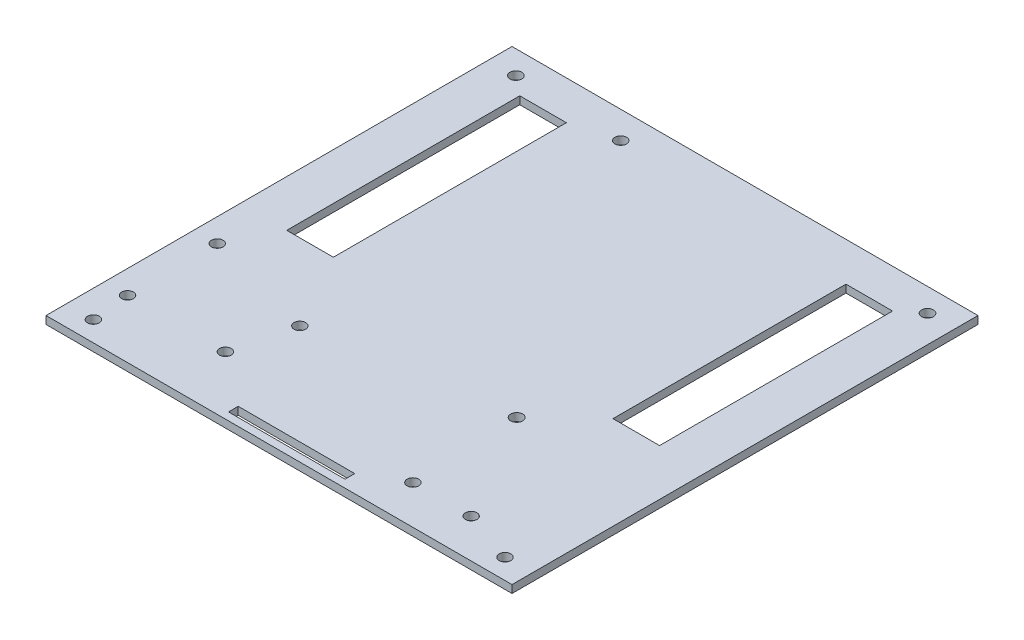
from build123d import *

# Parameters (mm, degrees)
SKETCH1_W           = 120
SKETCH1_H           = 120
BOSS_EXTRUDE1_DEPTH = 2
SKETCH2_R           = 1.525
SKETCH2_R_2         = 1.5
CUT_EXTRUDE1_DEPTH  = 2
SKETCH4_R           = 1.5
SKETCH4_R_2         = 1.55
SKETCH4_W           = 12
SKETCH4_H           = 60
CUT_EXTRUDE2_DEPTH  = 85.876380696
SKETCH5_R           = 1.5
SKETCH5_W           = 30
SKETCH5_H           = 2.5
CUT_EXTRUDE3_DEPTH  = 85.876380696


with BuildPart() as part:
    # Sketch1 → Boss-Extrude1 (new body)
    with BuildSketch(Plane(origin=(0, 0, 0), x_dir=(1, 0, 0), z_dir=(0, 1, 0))):
        Rectangle(SKETCH1_W, SKETCH1_H)
    extrude(amount=BOSS_EXTRUDE1_DEPTH)

    # Sketch2 → Cut-Extrude1 (cut)
    with BuildSketch(Plane(origin=(0, 2, 0), x_dir=(1, 0, 0), z_dir=(0, 1, 0))):
        with Locations(Location((-53, 54, 0), (0, 0, 270))):
            Circle(SKETCH2_R)
        with Locations(Location((-53, -54.8, 0), (0, 0, 270))):
            Circle(SKETCH2_R_2)
        with Locations(Location((53, 54, 0), (0, 0, 90))):
            Circle(SKETCH2_R)
        with Locations(Location((53, -54.8, 0), (0, 0, 90))):
            Circle(SKETCH2_R_2)
    extrude(amount=-CUT_EXTRUDE1_DEPTH, mode=Mode.SUBTRACT)

    # Sketch4 → Cut-Extrude2 (cut, through all)
    with BuildSketch(Plane(origin=(0, 2, 0), x_dir=(1, 0, 0), z_dir=(0, 1, 0))):
        with Locations(Location((-25, 53, 0), (0, 0, 270))):
            Circle(SKETCH4_R)
        with Locations(Location((-25, -29.63, 0), (0, 0, 270))):
            Circle(SKETCH4_R)
        with Locations(Location((23.34, -22.13, 0), (0, 0, 270))):
            Circle(SKETCH4_R_2)
        with Locations((-42, 20)):
            Rectangle(SKETCH4_W, SKETCH4_H)
        with Locations((42, 20)):
            Rectangle(SKETCH4_W, SKETCH4_H)
    extrude(amount=-CUT_EXTRUDE2_DEPTH, mode=Mode.SUBTRACT)

    # Sketch5 → Cut-Extrude3 (cut, through all)
    with BuildSketch(Plane(origin=(0, 2, 0), x_dir=(1, 0, 0), z_dir=(0, 1, 0))):
        with Locations(Location((-54, -45, 0), (0, 0, 270))):
            Circle(SKETCH5_R)
        with Locations(Location((-28.82, -45, 0), (0, 0, 270))):
            Circle(SKETCH5_R)
        with Locations(Location((-54, -21.9, 0), (0, 0, 270))):
            Circle(SKETCH5_R)
        with Locations(Location((24.479587092, -50, 0), (0, 0, 270))):
            Circle(SKETCH5_R)
        with Locations(Location((39.479587092, -50, 0), (0, 0, 270))):
            Circle(SKETCH5_R)
        with Locations((0, -56.75)):
            Rectangle(SKETCH5_W, SKETCH5_H)
    extrude(amount=-CUT_EXTRUDE3_DEPTH, mode=Mode.SUBTRACT)


solid = part.part
